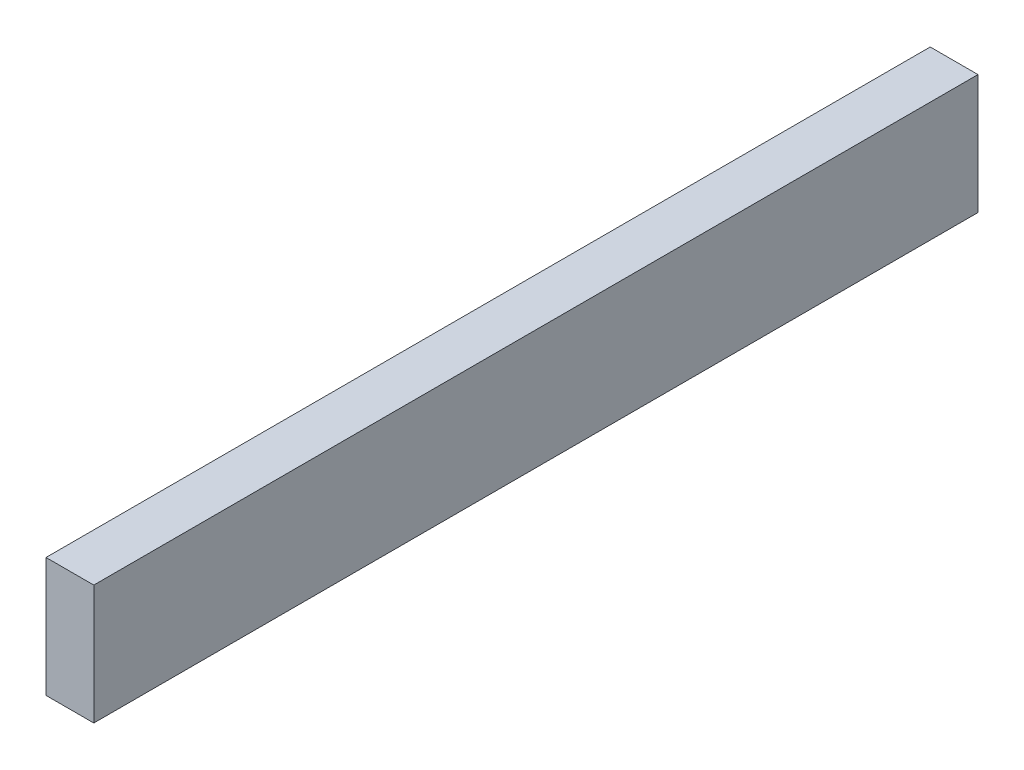
from build123d import *

# Parameters (mm, degrees)
SKETCH2_W           = 185
SKETCH2_H           = 25
BOSS_EXTRUDE1_DEPTH = 10


with BuildPart() as part:
    # Sketch2 → Boss-Extrude1 (new body)
    with BuildSketch(Plane(origin=(0, 0, 0), x_dir=(0, 0, -1), z_dir=(1, 0, 0))):
        with Locations((92.5, 12.5)):
            Rectangle(SKETCH2_W, SKETCH2_H)
    extrude(amount=BOSS_EXTRUDE1_DEPTH)


solid = part.part
